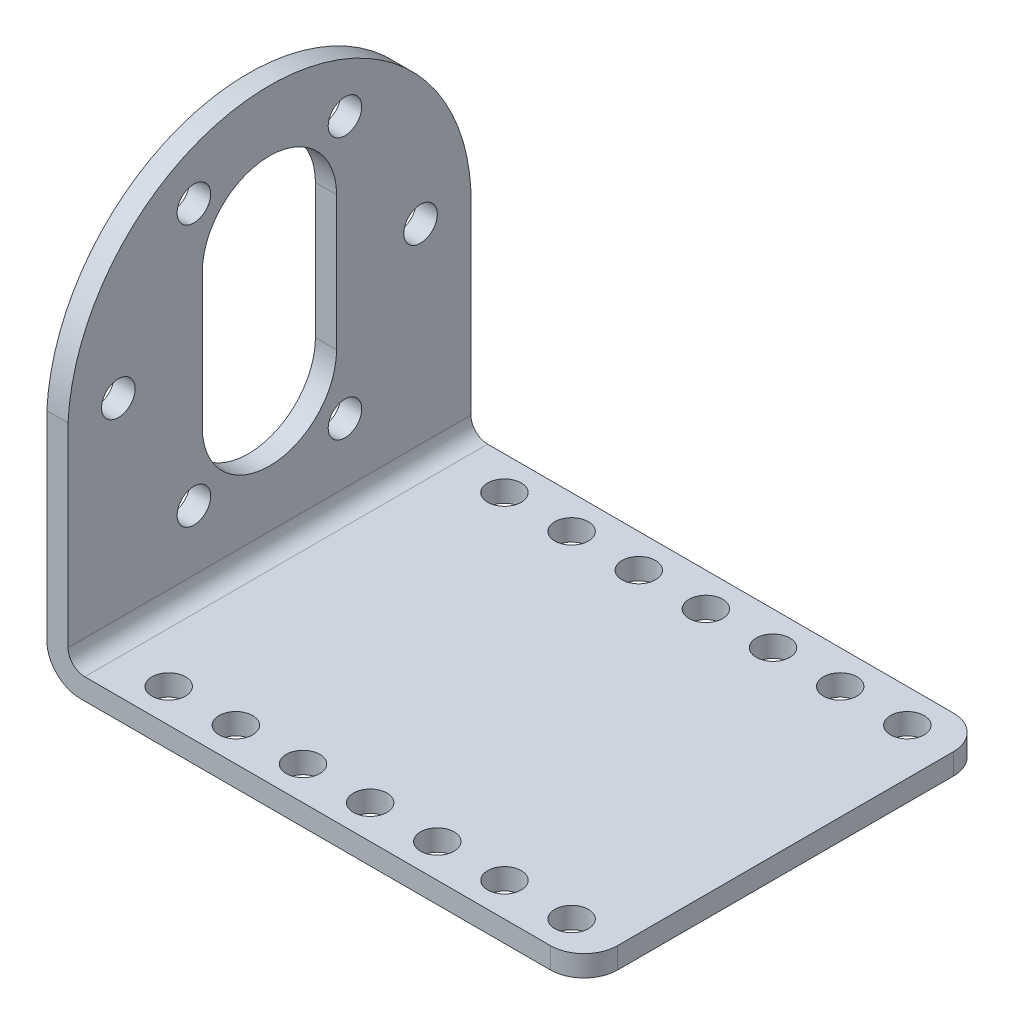
from build123d import *

# Parameters (mm, degrees)
SKETCH1_W               = 50.8
SKETCH1_H               = 38.1
BOSS_EXTRUDE1_DEPTH     = 2
SKETCH2_W               = 2
SKETCH2_H               = 38.1
BOSS_EXTRUDE2_DEPTH     = 38.1
CUT_EXTRUDE2_DEPTH      = 38.1
SKETCH4_R               = 1.5875
CUT_EXTRUDE3_DEPTH      = 2
LPATTERN1_COUNT         = 7
LPATTERN1_PITCH         = 6.35
MIRROR1_COPY_1_SKETCH_R = 1.5875
MIRROR1_COPY_1_DEPTH    = 2
MIRROR1_COPY_2_SKETCH_R = 1.5875
MIRROR1_COPY_2_DEPTH    = 2
MIRROR1_COPY_3_SKETCH_R = 1.5875
MIRROR1_COPY_3_DEPTH    = 2
MIRROR1_COPY_4_SKETCH_R = 1.5875
MIRROR1_COPY_4_DEPTH    = 2
MIRROR1_COPY_5_SKETCH_R = 1.5875
MIRROR1_COPY_5_DEPTH    = 2
MIRROR1_COPY_6_SKETCH_R = 1.5875
MIRROR1_COPY_6_DEPTH    = 2
FILLET1_R               = 3.175
FILLET2_R               = 1.5875
FILLET3_R               = 3.175
SKETCH5_R               = 1.5875
CUT_EXTRUDE4_DEPTH      = 68.46519473


with BuildPart() as part:
    # Sketch1 → Boss-Extrude1 (new body)
    with BuildSketch(Plane(origin=(0, 0, 0), x_dir=(1, 0, 0), z_dir=(0, 1, 0))):
        Rectangle(SKETCH1_W, SKETCH1_H)
    extrude(amount=BOSS_EXTRUDE1_DEPTH)

    # Sketch2 → Boss-Extrude2 (add)
    with BuildSketch(Plane(origin=(0, 2, 0), x_dir=(1, 0, 0), z_dir=(0, 1, 0))):
        with Locations((-24.4, 0)):
            Rectangle(SKETCH2_W, SKETCH2_H)
    extrude(amount=BOSS_EXTRUDE2_DEPTH)

    # Sketch3 → Cut-Extrude2 (cut)
    with BuildSketch(Plane.ZY.offset(25.4)):
        with BuildLine():
            Line((19.05, 40.1), (0, 40.1))
            ThreePointArc((0, 40.1), (13.138759324, 34.85352032), (19.05, 22.000124688))
            Line((19.05, 22.000124688), (19.05, 40.1))
        make_face()
        with BuildLine():
            Line((-19.05, 40.1), (-19.05, 22.000124688))
            ThreePointArc((-19.05, 22.000124688), (-13.138759324, 34.85352032), (0, 40.1))
            Line((0, 40.1), (-19.05, 40.1))
        make_face()
    extrude(amount=-CUT_EXTRUDE2_DEPTH, mode=Mode.SUBTRACT)

    # Sketch4 → Cut-Extrude3 (cut)
    with BuildSketch(Plane(origin=(0, 2, 0), x_dir=(1, 0, 0), z_dir=(0, 1, 0))):
        with Locations(Location((-17.05, 15.875, 0), (0, 0, 270))):
            Circle(SKETCH4_R)
    cut_extrude3 = extrude(amount=-CUT_EXTRUDE3_DEPTH, mode=Mode.SUBTRACT)

    # LPattern1: Cut-Extrude3 ×7
    with Locations(*[(i * LPATTERN1_PITCH, 0, 0) for i in range(1, LPATTERN1_COUNT)]):
        add(cut_extrude3, mode=Mode.SUBTRACT)

    # Mirror1: Cut-Extrude3 across plane
    add(cut_extrude3.mirror(Plane.XY), mode=Mode.SUBTRACT)

    # Mirror1 copy 1 sketch → Mirror1 copy 1 (cut)
    with BuildSketch(Plane(origin=(6.35, 2, 0), x_dir=(1, 0, 0), z_dir=(0, 1, 0))):
        with Locations((-17.05, -15.875)):
            Circle(MIRROR1_COPY_1_SKETCH_R)
    extrude(amount=-MIRROR1_COPY_1_DEPTH, mode=Mode.SUBTRACT)

    # Mirror1 copy 2 sketch → Mirror1 copy 2 (cut)
    with BuildSketch(Plane(origin=(12.7, 2, 0), x_dir=(1, 0, 0), z_dir=(0, 1, 0))):
        with Locations((-17.05, -15.875)):
            Circle(MIRROR1_COPY_2_SKETCH_R)
    extrude(amount=-MIRROR1_COPY_2_DEPTH, mode=Mode.SUBTRACT)

    # Mirror1 copy 3 sketch → Mirror1 copy 3 (cut)
    with BuildSketch(Plane(origin=(19.05, 2, 0), x_dir=(1, 0, 0), z_dir=(0, 1, 0))):
        with Locations((-17.05, -15.875)):
            Circle(MIRROR1_COPY_3_SKETCH_R)
    extrude(amount=-MIRROR1_COPY_3_DEPTH, mode=Mode.SUBTRACT)

    # Mirror1 copy 4 sketch → Mirror1 copy 4 (cut)
    with BuildSketch(Plane(origin=(25.4, 2, 0), x_dir=(1, 0, 0), z_dir=(0, 1, 0))):
        with Locations((-17.05, -15.875)):
            Circle(MIRROR1_COPY_4_SKETCH_R)
    extrude(amount=-MIRROR1_COPY_4_DEPTH, mode=Mode.SUBTRACT)

    # Mirror1 copy 5 sketch → Mirror1 copy 5 (cut)
    with BuildSketch(Plane(origin=(31.75, 2, 0), x_dir=(1, 0, 0), z_dir=(0, 1, 0))):
        with Locations((-17.05, -15.875)):
            Circle(MIRROR1_COPY_5_SKETCH_R)
    extrude(amount=-MIRROR1_COPY_5_DEPTH, mode=Mode.SUBTRACT)

    # Mirror1 copy 6 sketch → Mirror1 copy 6 (cut)
    with BuildSketch(Plane(origin=(38.1, 2, 0), x_dir=(1, 0, 0), z_dir=(0, 1, 0))):
        with Locations((-17.05, -15.875)):
            Circle(MIRROR1_COPY_6_SKETCH_R)
    extrude(amount=-MIRROR1_COPY_6_DEPTH, mode=Mode.SUBTRACT)

    # Fillet1
    fillet1_edges = [part.edges().sort_by_distance(p)[0] for p in [
        (25.4, 1, 19.05),
        (25.4, 1, -19.05),
    ]]
    fillet(fillet1_edges, radius=FILLET1_R)

    # Fillet2
    fillet2_edges = [part.edges().sort_by_distance(p)[0] for p in [
        (-23.4, 2, 0),
    ]]
    fillet(fillet2_edges, radius=FILLET2_R)

    # Fillet3
    fillet3_edges = [part.edges().sort_by_distance(p)[0] for p in [
        (-25.4, 0, 0),
    ]]
    fillet(fillet3_edges, radius=FILLET3_R)

    # Sketch5 → Cut-Extrude4 (cut, through all)
    with BuildSketch(Plane.ZY.offset(25.4)):
        with Locations((14.2875, 21.6375)):
            Circle(SKETCH5_R)
        with Locations((7.14375, 9.264162043)):
            Circle(SKETCH5_R)
        with Locations((-7.14375, 9.264162043)):
            Circle(SKETCH5_R)
        with Locations((-14.2875, 21.6375)):
            Circle(SKETCH5_R)
        with Locations((-7.14375, 34.010837957)):
            Circle(SKETCH5_R)
        with Locations((7.14375, 34.010837957)):
            Circle(SKETCH5_R)
        with BuildLine():
            Line((-6.35, 27.9875), (-6.35, 15.2875))
            ThreePointArc((-6.35, 15.2875), (0, 8.9375), (6.35, 15.2875))
            Line((6.35, 15.2875), (6.35, 27.9875))
            ThreePointArc((6.35, 27.9875), (0, 34.3375), (-6.35, 27.9875))
        make_face()
    extrude(amount=-CUT_EXTRUDE4_DEPTH, mode=Mode.SUBTRACT)


solid = part.part
